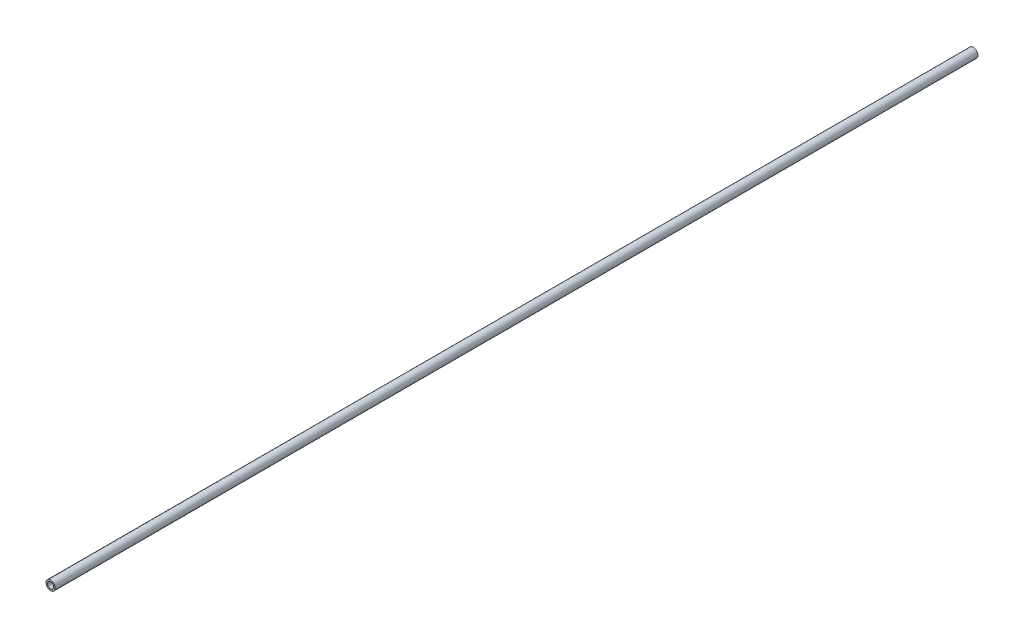
from build123d import *

# Parameters (mm, degrees)
SCHIZZO1_R                   = 3
SCHIZZO1_R_2                 = 2
ESTRUSIONE_ESTRUSIONE1_DEPTH = 599


with BuildPart() as part:
    # Schizzo1 → Estrusione-Estrusione1 (new body)
    with BuildSketch(Plane.XY):
        Circle(SCHIZZO1_R)
        Circle(SCHIZZO1_R_2, mode=Mode.SUBTRACT)
    extrude(amount=ESTRUSIONE_ESTRUSIONE1_DEPTH)


solid = part.part
